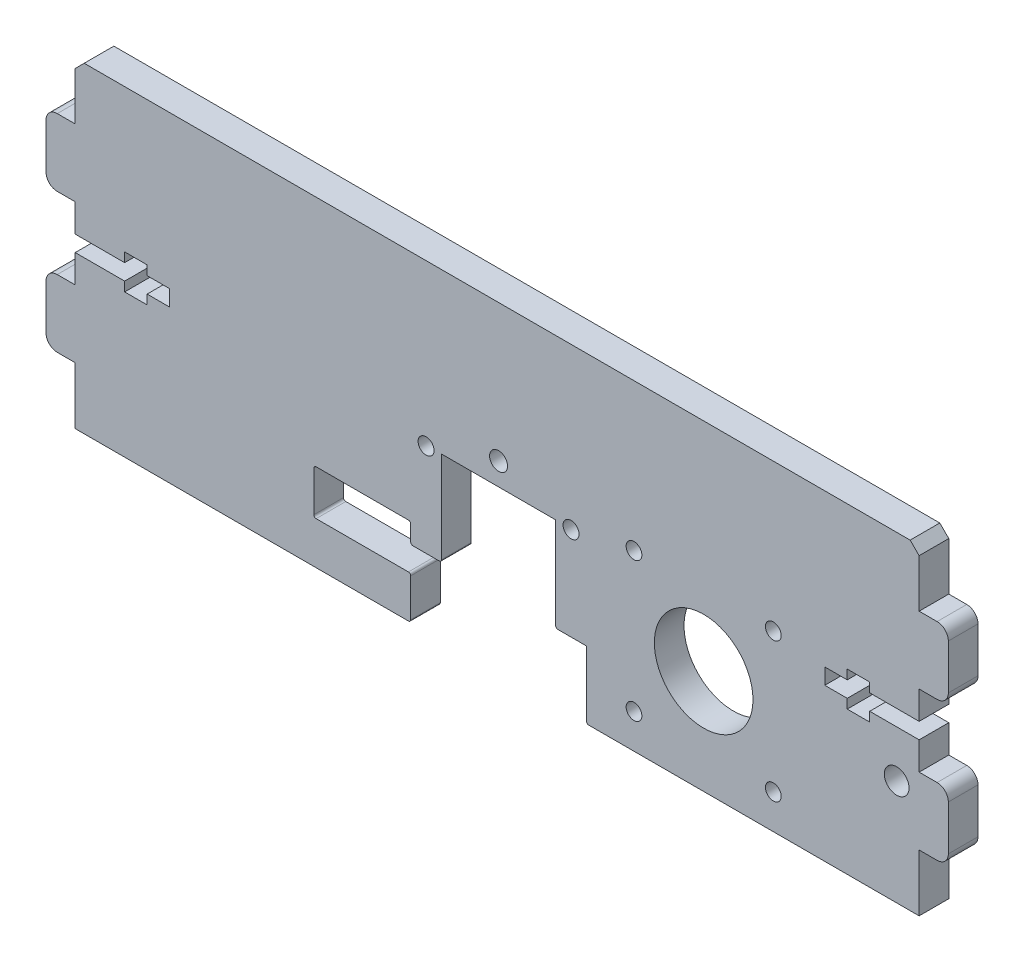
from build123d import *

# Parameters (mm, degrees)
MODEL_R             = 1.7526
MODEL_R_2           = 10.975
MODEL_R_3           = 2
MODEL_R_4           = 2.75
MODEL_R_5           = 1.775
BOSS_EXTRUDE1_DEPTH = 6.6


with BuildPart() as part:
    # Model → Boss-Extrude1 (new body)
    with BuildSketch(Plane.XY):
        with BuildLine():
            Line((0, 0), (74.150001665, 0))
            ThreePointArc((74.150001665, 0), (74.503555056, 0.146446609), (74.650001665, 0.5))
            Line((74.650001665, 0.5), (74.650001665, 8.9613))
            ThreePointArc((74.650001665, 8.9613), (74.503555056, 9.314853391), (74.150001665, 9.4613))
            Line((74.150001665, 9.4613), (53.610001665, 9.4613))
            ThreePointArc((53.610001665, 9.4613), (53.256448274, 9.607746609), (53.110001665, 9.9613))
            Line((53.110001665, 9.9613), (53.110001665, 18.9557))
            ThreePointArc((53.110001665, 18.9557), (53.256448274, 19.309253391), (53.610001665, 19.4557))
            Line((53.610001665, 19.4557), (74.150001665, 19.4557))
            ThreePointArc((74.150001665, 19.4557), (74.503555056, 19.309253391), (74.650001665, 18.9557))
            Line((74.650001665, 18.9557), (74.650001665, 15.5))
            ThreePointArc((74.650001665, 15.5), (74.796448274, 15.146446609), (75.150001665, 15))
            Line((75.150001665, 15), (81.010001665, 15))
            ThreePointArc((81.010001665, 15), (81.363555056, 15.146446609), (81.510001665, 15.5))
            Line((81.510001665, 15.5), (81.510001665, 35.87480678))
            Line((81.510001665, 35.87480678), (106.910001664, 35.87480678))
            Line((106.910001664, 35.87480678), (106.910001664, 15.5))
            ThreePointArc((106.910001664, 15.5), (107.056448274, 15.146446609), (107.410001664, 15))
            Line((107.410001664, 15), (113.770001664, 15))
            Line((113.770001664, 15), (113.770001664, 0.5))
            ThreePointArc((113.770001664, 0.5), (113.916448274, 0.146446609), (114.270001664, 0))
            Line((114.270001664, 0), (187.8, 0))
            Line((187.8, 0), (187.8, 12.7))
            Line((187.8, 12.7), (191.8, 12.7))
            ThreePointArc((191.8, 12.7), (193.567766953, 13.432233047), (194.3, 15.2))
            Line((194.3, 15.2), (194.3, 25.2))
            ThreePointArc((194.3, 25.2), (193.567766953, 26.967766953), (191.8, 27.7))
            Line((191.8, 27.7), (187.8, 27.7))
            Line((187.8, 27.7), (187.8, 33.935))
            Line((187.8, 33.935), (176.8, 33.935))
            Line((176.8, 33.935), (176.8, 31.85))
            Line((176.8, 31.85), (171.8, 31.85))
            Line((171.8, 31.85), (171.8, 33.935))
            Line((171.8, 33.935), (166.8, 33.935))
            Line((166.8, 33.935), (166.8, 37.485))
            Line((166.8, 37.485), (171.8, 37.485))
            Line((171.8, 37.485), (171.8, 39.57))
            Line((171.8, 39.57), (176.8, 39.57))
            Line((176.8, 39.57), (176.8, 37.485))
            Line((176.8, 37.485), (187.8, 37.485))
            Line((187.8, 37.485), (187.8, 43.72))
            Line((187.8, 43.72), (191.8, 43.72))
            ThreePointArc((191.8, 43.72), (193.567766953, 44.452233047), (194.3, 46.22))
            Line((194.3, 46.22), (194.3, 56.22))
            ThreePointArc((194.3, 56.22), (193.567766953, 57.987766953), (191.8, 58.72))
            Line((191.8, 58.72), (187.8, 58.72))
            Line((187.8, 58.72), (187.8, 69.42))
            Line((187.8, 69.42), (185.8, 71.42))
            Line((185.8, 71.42), (2, 71.42))
            Line((2, 71.42), (0, 69.42))
            Line((0, 69.42), (0, 58.72))
            Line((0, 58.72), (-4, 58.72))
            ThreePointArc((-4, 58.72), (-5.767766953, 57.987766953), (-6.5, 56.22))
            Line((-6.5, 56.22), (-6.5, 46.22))
            ThreePointArc((-6.5, 46.22), (-5.767766953, 44.452233047), (-4, 43.72))
            Line((-4, 43.72), (0, 43.72))
            Line((0, 43.72), (0, 37.485))
            Line((0, 37.485), (11, 37.485))
            Line((11, 37.485), (11, 39.57))
            Line((11, 39.57), (16, 39.57))
            Line((16, 39.57), (16, 37.485))
            Line((16, 37.485), (21, 37.485))
            Line((21, 37.485), (21, 33.935))
            Line((21, 33.935), (16, 33.935))
            Line((16, 33.935), (16, 31.85))
            Line((16, 31.85), (11, 31.85))
            Line((11, 31.85), (11, 33.935))
            Line((11, 33.935), (0, 33.935))
            Line((0, 33.935), (0, 27.7))
            Line((0, 27.7), (-4, 27.7))
            ThreePointArc((-4, 27.7), (-5.767766953, 26.967766953), (-6.5, 25.2))
            Line((-6.5, 25.2), (-6.5, 15.2))
            ThreePointArc((-6.5, 15.2), (-5.767766953, 13.432233047), (-4, 12.7))
            Line((-4, 12.7), (0, 12.7))
            Line((0, 12.7), (0, 0))
        make_face()
        with Locations((155.352001664, 38.674806781)):
            Circle(MODEL_R, mode=Mode.SUBTRACT)
        with Locations((155.352001664, 7.674806781)):
            Circle(MODEL_R, mode=Mode.SUBTRACT)
        with Locations((124.352001664, 38.674806781)):
            Circle(MODEL_R, mode=Mode.SUBTRACT)
        with Locations((124.352001664, 7.674806781)):
            Circle(MODEL_R, mode=Mode.SUBTRACT)
        with Locations((139.852001664, 23.174806781)):
            Circle(MODEL_R_2, mode=Mode.SUBTRACT)
        with Locations((94.210001665, 40.87480678)):
            Circle(MODEL_R_3, mode=Mode.SUBTRACT)
        with Locations((182.8, 23.5)):
            Circle(MODEL_R_4, mode=Mode.SUBTRACT)
        with Locations((110.340001664, 35.71)):
            Circle(MODEL_R_5, mode=Mode.SUBTRACT)
        with Locations((78.080001665, 35.71)):
            Circle(MODEL_R_5, mode=Mode.SUBTRACT)
    extrude(amount=BOSS_EXTRUDE1_DEPTH)


solid = part.part
